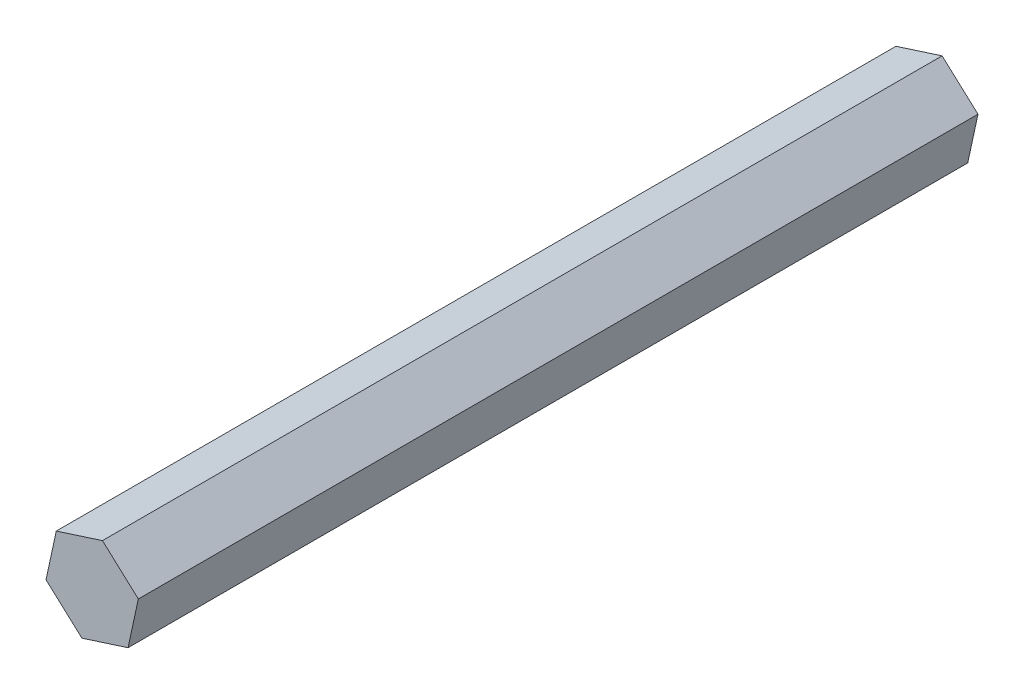
from build123d import *

# Parameters (mm, degrees)
BOSS_EXTRUDE1_DEPTH = 50


with BuildPart() as part:
    # Sketch1 → Boss-Extrude1 (new body)
    with BuildSketch(Plane.XY):
        Polygon((2.137295047, -1.940438924), (2.749116926, 0.880732344), (0.611821879, 2.821171268), (-2.137295047, 1.940438924), (-2.749116926, -0.880732344), (-0.611821879, -2.821171268), align=None)
    extrude(amount=BOSS_EXTRUDE1_DEPTH)


solid = part.part
